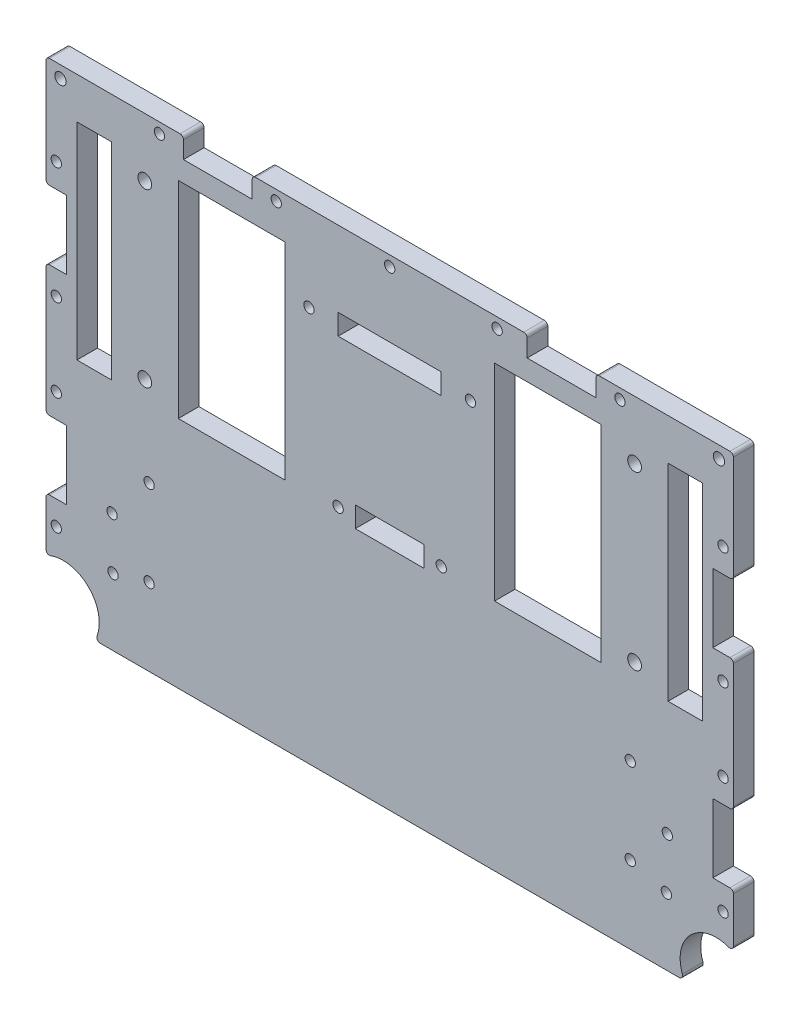
from build123d import *

# Parameters (mm, degrees)
ESQUISSE1_W              = 200
ESQUISSE1_H              = 140
BOSS_EXTRU_1_DEPTH       = 6
ESQUISSE8_W              = 31
ESQUISSE8_H              = 60
ESQUISSE8_W_2            = 10
ENL_V_MAT_EXTRU_2_DEPTH  = 6
ESQUISSE9_W              = 20
ESQUISSE9_H              = 6
ENL_V_MAT_EXTRU_3_DEPTH  = 6
ESQUISSE10_W             = 6
ESQUISSE10_H             = 20
ENL_V_MAT_EXTRU_4_DEPTH  = 6
ESQUISSE14_W             = 30
ESQUISSE14_H             = 6
ENL_V_MAT_EXTRU_7_DEPTH  = 6
ESQUISSE15_R             = 10.5
ENL_V_MAT_EXTRU_8_DEPTH  = 6
ESQUISSE19_R             = 2
ENL_V_MAT_EXTRU_11_DEPTH = 245.204832057
ESQUISSE20_R             = 1.5
ENL_V_MAT_EXTRU_12_DEPTH = 245.204832057
ESQUISSE21_R             = 1.5
ESQUISSE21_W             = 20
ESQUISSE21_H             = 6
ENL_V_MAT_EXTRU_13_DEPTH = 10
ESQUISSE23_R             = 1.65
ENL_V_MAT_EXTRU_15_DEPTH = 6
ESQUISSE16_R             = 1.5
ENL_V_MAT_EXTRU_9_DEPTH  = 6
ESQUISSE28_W             = 6
ESQUISSE28_H             = 20
ENL_V_MAT_EXTRU_17_DEPTH = 245.204832057
ESQUISSE29_R             = 1.5
ENL_V_MAT_EXTRU_18_DEPTH = 245.204832057
ESQUISSE35_R             = 1.5
ENL_V_MAT_EXTRU_21_DEPTH = 6
CONG_1_R                 = 1


with BuildPart() as part:
    # Esquisse1 → Boss.-Extru.1 (new body)
    with BuildSketch(Plane.XY):
        with Locations((100, -70)):
            Rectangle(ESQUISSE1_W, ESQUISSE1_H)
    extrude(amount=BOSS_EXTRU_1_DEPTH)

    # Esquisse8 → Enlèv. mat.-Extru.2 (cut)
    with BuildSketch(Plane(origin=(0, 0, 0), x_dir=(-1, 0, 0), z_dir=(0, 0, -1))):
        with Locations((-146, -42)):
            Rectangle(ESQUISSE8_W, ESQUISSE8_H)
        with Locations((-186, -42)):
            Rectangle(ESQUISSE8_W_2, ESQUISSE8_H)
        with Locations((-14, -42)):
            Rectangle(ESQUISSE8_W_2, ESQUISSE8_H)
        with Locations((-54, -42)):
            Rectangle(ESQUISSE8_W, ESQUISSE8_H)
    extrude(amount=-ENL_V_MAT_EXTRU_2_DEPTH, mode=Mode.SUBTRACT)

    # Esquisse9 → Enlèv. mat.-Extru.3 (cut)
    with BuildSketch(Plane(origin=(0, 0, 0), x_dir=(-1, 0, 0), z_dir=(0, 0, -1))):
        with Locations((-150, -3)):
            Rectangle(ESQUISSE9_W, ESQUISSE9_H)
        with Locations((-50, -3)):
            Rectangle(ESQUISSE9_W, ESQUISSE9_H)
    extrude(amount=-ENL_V_MAT_EXTRU_3_DEPTH, mode=Mode.SUBTRACT)

    # Esquisse10 → Enlèv. mat.-Extru.4 (cut)
    with BuildSketch(Plane(origin=(0, 0, 0), x_dir=(-1, 0, 0), z_dir=(0, 0, -1))):
        with Locations((-197, -100)):
            Rectangle(ESQUISSE10_W, ESQUISSE10_H)
        with Locations((-3, -100)):
            Rectangle(ESQUISSE10_W, ESQUISSE10_H)
    extrude(amount=-ENL_V_MAT_EXTRU_4_DEPTH, mode=Mode.SUBTRACT)

    # Esquisse14 → Enlèv. mat.-Extru.7 (cut)
    with BuildSketch(Plane.XY.offset(6)):
        with Locations((100, -25)):
            Rectangle(ESQUISSE14_W, ESQUISSE14_H)
    extrude(amount=-ENL_V_MAT_EXTRU_7_DEPTH, mode=Mode.SUBTRACT)

    # Esquisse15 → Enlèv. mat.-Extru.8 (cut)
    with BuildSketch(Plane.XY.offset(6)):
        with Locations((195, -135)):
            Circle(ESQUISSE15_R)
        with Locations((5, -135)):
            Circle(ESQUISSE15_R)
    extrude(amount=-ENL_V_MAT_EXTRU_8_DEPTH, mode=Mode.SUBTRACT)

    # Esquisse19 → Enlèv. mat.-Extru.11 (cut, through all)
    with BuildSketch(Plane(origin=(0, 0, 0), x_dir=(-1, 0, 0), z_dir=(0, 0, -1))):
        with Locations((-28.75, -67)):
            Circle(ESQUISSE19_R)
        with Locations((-28.75, -17)):
            Circle(ESQUISSE19_R)
        with Locations((-171.25, -17)):
            Circle(ESQUISSE19_R)
        with Locations((-171.25, -67)):
            Circle(ESQUISSE19_R)
    extrude(amount=-ENL_V_MAT_EXTRU_11_DEPTH, mode=Mode.SUBTRACT)

    # Esquisse20 → Enlèv. mat.-Extru.12 (cut, through all)
    with BuildSketch(Plane.XY.offset(6)):
        with Locations((19.495689014, -120.504310986)):
            Circle(ESQUISSE20_R)
        with Locations((19.212846302, -105.506977889)):
            Circle(ESQUISSE20_R)
        with Locations((180.787153698, -105.506977889)):
            Circle(ESQUISSE20_R)
        with Locations((30, -117.5)):
            Circle(ESQUISSE20_R)
        with Locations((30, -92.5)):
            Circle(ESQUISSE20_R)
        with Locations((180.504310986, -120.504310986)):
            Circle(ESQUISSE20_R)
        with Locations((170, -92.5)):
            Circle(ESQUISSE20_R)
        with Locations((170, -117.5)):
            Circle(ESQUISSE20_R)
        with Locations((76.5, -25)):
            Circle(ESQUISSE20_R)
        with Locations((123.5, -25)):
            Circle(ESQUISSE20_R)
    extrude(amount=-ENL_V_MAT_EXTRU_12_DEPTH, mode=Mode.SUBTRACT)

    # Esquisse21 → Enlèv. mat.-Extru.13 (cut)
    with BuildSketch(Plane(origin=(0, 0, 0), x_dir=(-1, 0, 0), z_dir=(0, 0, -1))):
        with Locations((-85, -71)):
            Circle(ESQUISSE21_R)
        with Locations((-115, -71)):
            Circle(ESQUISSE21_R)
        with Locations((-100, -71)):
            Rectangle(ESQUISSE21_W, ESQUISSE21_H)
    extrude(amount=-ENL_V_MAT_EXTRU_13_DEPTH, mode=Mode.SUBTRACT)

    # Esquisse23 → Enlèv. mat.-Extru.15 (cut)
    with BuildSketch(Plane(origin=(0, 0, 0), x_dir=(-1, 0, 0), z_dir=(0, 0, -1))):
        with Locations((-4.2, -3.5)):
            Circle(ESQUISSE23_R)
        with Locations((-195.8, -3.5)):
            Circle(ESQUISSE23_R)
    extrude(amount=-ENL_V_MAT_EXTRU_15_DEPTH, mode=Mode.SUBTRACT)

    # Esquisse16 → Enlèv. mat.-Extru.9 (cut)
    with BuildSketch(Plane(origin=(0, 0, 0), x_dir=(-1, 0, 0), z_dir=(0, 0, -1))):
        with Locations((-3, -83)):
            Circle(ESQUISSE16_R)
        with Locations((-197, -117)):
            Circle(ESQUISSE16_R)
        with Locations((-197, -83)):
            Circle(ESQUISSE16_R)
        with Locations((-3, -117)):
            Circle(ESQUISSE16_R)
    extrude(amount=-ENL_V_MAT_EXTRU_9_DEPTH, mode=Mode.SUBTRACT)

    # Esquisse28 → Enlèv. mat.-Extru.17 (cut, through all)
    with BuildSketch(Plane.XY.offset(6)):
        with Locations((3, -42)):
            Rectangle(ESQUISSE28_W, ESQUISSE28_H)
        with Locations((197, -42)):
            Rectangle(ESQUISSE28_W, ESQUISSE28_H)
    extrude(amount=-ENL_V_MAT_EXTRU_17_DEPTH, mode=Mode.SUBTRACT)

    # Esquisse29 → Enlèv. mat.-Extru.18 (cut, through all)
    with BuildSketch(Plane(origin=(0, 0, 0), x_dir=(-1, 0, 0), z_dir=(0, 0, -1))):
        with Locations((-197, -25)):
            Circle(ESQUISSE29_R)
        with Locations((-197, -59)):
            Circle(ESQUISSE29_R)
        with Locations((-3, -59)):
            Circle(ESQUISSE29_R)
        with Locations((-3, -25)):
            Circle(ESQUISSE29_R)
    extrude(amount=-ENL_V_MAT_EXTRU_18_DEPTH, mode=Mode.SUBTRACT)

    # Esquisse35 → Enlèv. mat.-Extru.21 (cut)
    with BuildSketch(Plane(origin=(0, 0, 0), x_dir=(-1, 0, 0), z_dir=(0, 0, -1))):
        with Locations((-167, -3)):
            Circle(ESQUISSE35_R)
        with Locations((-131.260401336, -3)):
            Circle(ESQUISSE35_R)
        with Locations((-100, -3)):
            Circle(ESQUISSE35_R)
        with Locations((-67, -3)):
            Circle(ESQUISSE35_R)
        with Locations((-33, -3)):
            Circle(ESQUISSE35_R)
    extrude(amount=-ENL_V_MAT_EXTRU_21_DEPTH, mode=Mode.SUBTRACT)

    # Congé1
    cong_1_edges = [part.edges().sort_by_distance(p)[0] for p in [
        (14.233092656, -140, 3),
        (0, -125.766907344, 3),
        (0, -110, 3),
        (0, -90, 3),
        (0, -52, 3),
        (0, -32, 3),
        (0, 0, 3),
        (40, 0, 3),
        (60, 0, 3),
        (140, 0, 3),
        (160, 0, 3),
        (200, 0, 3),
        (200, -32, 3),
        (200, -52, 3),
        (200, -110, 3),
        (200, -90, 3),
        (185.766907344, -140, 3),
        (200, -125.766907344, 3),
    ]]
    fillet(cong_1_edges, radius=CONG_1_R)


solid = part.part
